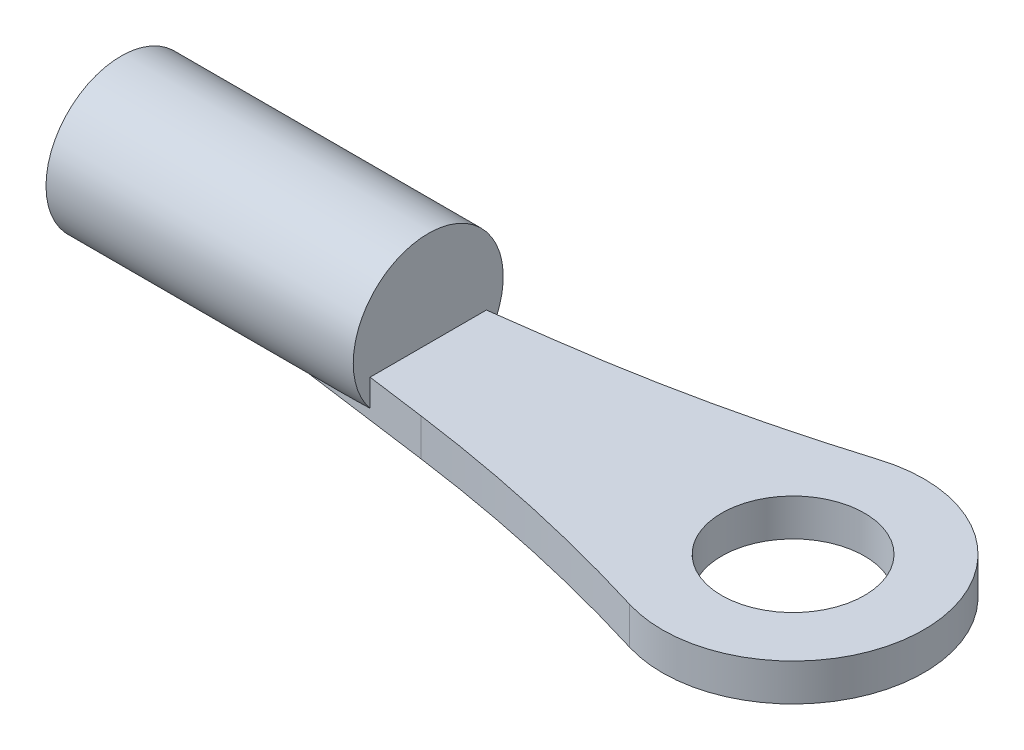
from build123d import *

# Parameters (mm, degrees)
SKETCH1_R           = 1.5113
BOSS_EXTRUDE1_DEPTH = 0.7874
SKETCH2_R           = 1.5875
BOSS_EXTRUDE2_DEPTH = 6.5024
SKETCH3_R           = 1.11850285
CUT_EXTRUDE1_DEPTH  = 2.54


with BuildPart() as part:
    # Sketch1 → Boss-Extrude1 (new body)
    with BuildSketch(Plane(origin=(0, 0, 0), x_dir=(1, 0, 0), z_dir=(0, 1, 0))):
        with BuildLine():
            Line((-6.468656663, -1.40130078), (-9.301119213, -1.016))
            Line((-9.301119213, -1.016), (-14.224, -1.016))
            Line((-14.224, -1.016), (-14.224, 0))
            Line((-14.224, 0), (-14.224, 1.016))
            Line((-14.224, 1.016), (-9.301119213, 1.016))
            Line((-9.301119213, 1.016), (-6.468656663, 1.40130078))
            ThreePointArc((-6.468656663, 1.40130078), (-3.615678691, 1.908544578), (-0.813473119, 2.646395179))
            ThreePointArc((-0.813473119, 2.646395179), (2.7686, 0), (-0.813473119, -2.646395179))
            ThreePointArc((-0.813473119, -2.646395179), (-3.615678691, -1.908544578), (-6.468656663, -1.40130078))
        make_face()
        with Locations(Location((0, 0, 0), (0, 0, 270))):
            Circle(SKETCH1_R, mode=Mode.SUBTRACT)
    extrude(amount=BOSS_EXTRUDE1_DEPTH)

    # Sketch2 → Boss-Extrude2 (add)
    with BuildSketch(Plane.ZY.offset(14.224)):
        with Locations((0, 1.219795167)):
            Circle(SKETCH2_R)
    extrude(amount=-BOSS_EXTRUDE2_DEPTH)

    # Sketch3 → Cut-Extrude1 (cut)
    with BuildSketch(Plane.ZY.offset(14.224)):
        with Locations((0, 1.219795167)):
            Circle(SKETCH3_R)
    extrude(amount=-CUT_EXTRUDE1_DEPTH, mode=Mode.SUBTRACT)


solid = part.part
